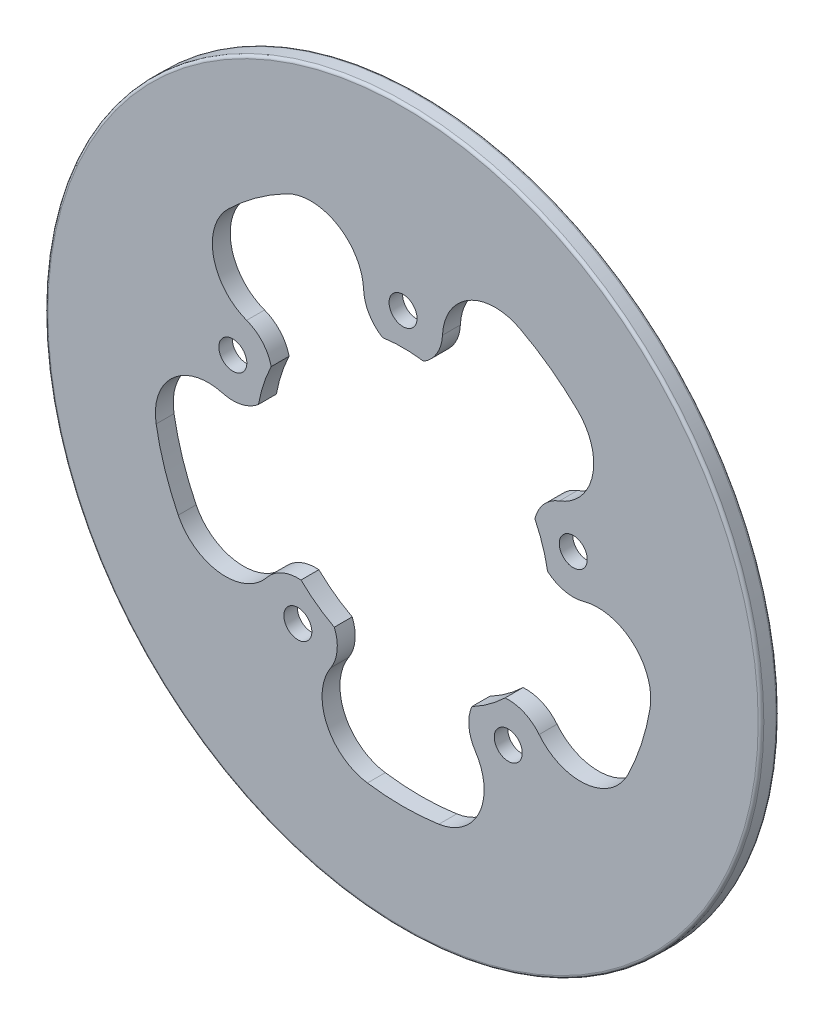
from build123d import *

# Parameters (mm, degrees)
SKETCH1_R                                        = 127
SKETCH1_R_2                                      = 52.07
BOSS_EXTRUDE1_DEPTH                              = 6.35
CBORE_FOR_3_8_SOCKET_HEAD_CAP_SCREW1_D           = 9.9314
CBORE_FOR_3_8_SOCKET_HEAD_CAP_SCREW1_CBORE_D     = 15.875
CBORE_FOR_3_8_SOCKET_HEAD_CAP_SCREW1_CBORE_DEPTH = 1.5494
CIRPATTERN1_COUNT                                = 5
CUT_EXTRUDE1_DEPTH                               = 180.717340566
FILLET1_R                                        = 1


with BuildPart() as part:
    # Sketch1 → Boss-Extrude1 (new body)
    with BuildSketch(Plane.XY):
        Circle(SKETCH1_R)
        Circle(SKETCH1_R_2, mode=Mode.SUBTRACT)
    extrude(amount=BOSS_EXTRUDE1_DEPTH)

    # CBORE for 3/8 Socket Head Cap Screw1 (through all)
    with Locations(Plane(origin=(0, 0, 0), x_dir=(-1, 0, 0), z_dir=(0, 0, -1))):
        with Locations((0, 63.5)):
            cbore_for_3_8_socket_head_cap_screw1 = CounterBoreHole(CBORE_FOR_3_8_SOCKET_HEAD_CAP_SCREW1_D / 2, CBORE_FOR_3_8_SOCKET_HEAD_CAP_SCREW1_CBORE_D / 2, CBORE_FOR_3_8_SOCKET_HEAD_CAP_SCREW1_CBORE_DEPTH)

    # CirPattern1: CBORE for 3/8 Socket Head Cap Screw1 ×5 about axis
    cirpattern1_axis = Axis((0, 0, 0), (0, 0, 1))
    for i in range(1, CIRPATTERN1_COUNT):
        add(cbore_for_3_8_socket_head_cap_screw1.rotate(cirpattern1_axis, i * 360 / CIRPATTERN1_COUNT), mode=Mode.SUBTRACT)

    # Sketch5 → Cut-Extrude1 (cut, through all)
    with BuildSketch(Plane(origin=(0, 0, 0), x_dir=(-1, 0, 0), z_dir=(0, 0, -1))):
        with BuildLine():
            ThreePointArc((-41.44563977, 78.647752314), (-52.234106188, 71.936139393), (-61.955600498, 63.755106203))
            ThreePointArc((-61.955600498, 63.755106203), (-67.246233615, 46.459424342), (-55.472312316, 32.729668808))
            ThreePointArc((-55.472312316, 32.729668808), (-49.895894595, 28.887022327), (-46.775498841, 22.876573349))
            ThreePointArc((-46.775498841, 22.876573349), (-49.521512803, 16.090514897), (-51.28868592, 8.986411775))
            ThreePointArc((-51.28868592, 8.986411775), (-57.354131533, 5.956167187), (-64.132133316, 6.131394358))
            ThreePointArc((-64.132133316, 6.131394358), (-81.713776835, 1.96678681), (-87.605864362, -15.11365374))
            ThreePointArc((-87.605864362, -15.11365374), (-84.556560625, -27.448097481), (-79.780042652, -39.22186628))
            ThreePointArc((-79.780042652, -39.22186628), (-64.965767259, -49.598217006), (-48.269652019, -42.64328022))
            ThreePointArc((-48.269652019, -42.64328022), (-42.8918702, -38.527234874), (-36.211338216, -37.416893037))
            ThreePointArc((-36.211338216, -37.416893037), (-30.605978087, -42.125514897), (-24.395661045, -46.001485))
            ThreePointArc((-24.395661045, -46.001485), (-23.388052957, -52.706463648), (-25.649221638, -59.098578238))
            ThreePointArc((-25.649221638, -59.098578238), (-27.121471128, -77.106649381), (-12.69776202, -87.98850402))
            ThreePointArc((-12.69776202, -87.98850402), (-0.02472225, -88.899996562), (12.648822515, -87.995552666))
            ThreePointArc((12.648822515, -87.995552666), (27.095181344, -77.112808233), (25.640026743, -59.084665376))
            ThreePointArc((25.640026743, -59.084665376), (23.38726097, -52.698162972), (24.395661045, -46.001485))
            ThreePointArc((24.395661045, -46.001485), (30.605978087, -42.125514897), (36.211338216, -37.416893037))
            ThreePointArc((36.211338216, -37.416893037), (42.899519875, -38.530553149), (48.280042559, -42.656324396))
            ThreePointArc((48.280042559, -42.656324396), (64.951785852, -49.621316886), (79.758215853, -39.266232363))
            ThreePointArc((79.758215853, -39.266232363), (84.541281434, -27.495121994), (87.597444884, -15.162376126))
            ThreePointArc((87.597444884, -15.162376126), (81.711510261, 1.939880549), (64.116060019, 6.126948804))
            ThreePointArc((64.116060019, 6.126948804), (57.345992383, 5.957979013), (51.28868592, 8.986411775))
            ThreePointArc((51.28868592, 8.986411775), (49.521512803, 16.090514897), (46.775498841, 22.876573349))
            ThreePointArc((46.775498841, 22.876573349), (49.901414341, 28.893272197), (55.487928918, 32.735519927))
            ThreePointArc((55.487928918, 32.735519927), (67.263882415, 46.438988979), (61.991050299, 63.720637809))
            ThreePointArc((61.991050299, 63.720637809), (52.274107628, 71.907076645), (41.48937575, 78.62468887))
            ThreePointArc((41.48937575, 78.62468887), (23.405309269, 78.311720347), (13.985877573, 62.871327984))
            ThreePointArc((13.985877573, 62.871327984), (12.054511442, 56.380396507), (7.302490092, 51.555392913))
            ThreePointArc((7.302490092, 51.555392913), (0, 52.07), (-7.302490092, 51.555392913))
            ThreePointArc((-7.302490092, 51.555392913), (-12.058749726, 56.387577413), (-13.986616522, 62.88798835))
            ThreePointArc((-13.986616522, 62.88798835), (-23.380420305, 78.322190478), (-41.44563977, 78.647752314))
        make_face()
    extrude(amount=-CUT_EXTRUDE1_DEPTH, mode=Mode.SUBTRACT)

    # Fillet1
    fillet1_edges = [part.edges().sort_by_distance(p)[0] for p in [
        (-127, 0, 0),
        (-127, 0, 6.35),
    ]]
    fillet(fillet1_edges, radius=FILLET1_R)


solid = part.part
